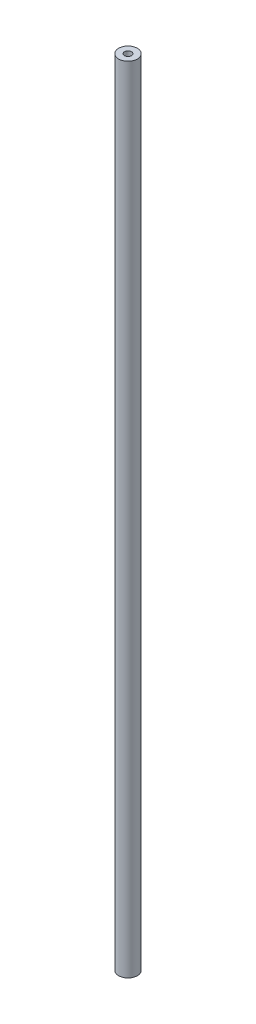
from build123d import *

# Parameters (mm, degrees)
SKETCH_1_R      = 2
SKETCH_1_R_2    = 0.75
EXTRUDE_1_DEPTH = 170


with BuildPart() as part:
    # 草图1 → 凸台-拉伸1 (new body)
    with BuildSketch(Plane(origin=(0, 0, 0), x_dir=(1, 0, 0), z_dir=(0, 1, 0))):
        with Locations(Location((-1.932069985, 1.410717767, 0), (0, 0, 270))):
            Circle(SKETCH_1_R)
        with Locations(Location((-1.932069985, 1.410717767, 0), (0, 0, 270))):
            Circle(SKETCH_1_R_2, mode=Mode.SUBTRACT)
    extrude(amount=EXTRUDE_1_DEPTH)


solid = part.part
